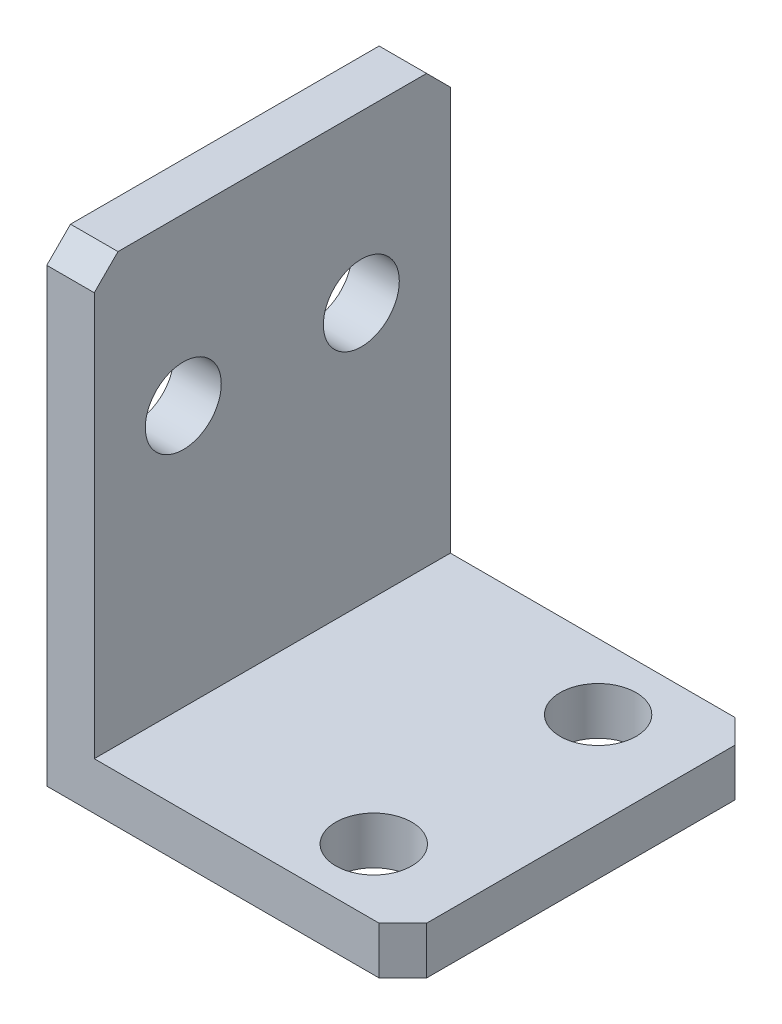
from build123d import *

# Parameters (mm, degrees)
BODY_DEPTH              = 15
CHAMFER1_SIZE           = 1
F_3_2_3_2_FORSENSOR_D   = 3.2
F_3_2_3_2_FORCARRIAGE_D = 3.2


with BuildPart() as part:
    # Sketch1 → Body (new body)
    with BuildSketch(Plane.XY):
        Polygon((0, 0), (0, 20), (2, 20), (2, 2), (15, 2), (15, 0), align=None)
    extrude(amount=BODY_DEPTH)

    # Chamfer1
    chamfer1_edges = [part.edges().sort_by_distance(p)[0] for p in [
        (1, 20, 15),
        (1, 20, 0),
        (15, 1, 15),
        (15, 1, 0),
    ]]
    chamfer(chamfer1_edges, length=CHAMFER1_SIZE)

    # Ø3.2 (3.2) ForSensor (through all)
    with Locations(Plane(origin=(0, 2, 0), x_dir=(1, 0, 0), z_dir=(0, 1, 0))):
        with Locations((11, -2.775), (11, -12.225)):
            Hole(F_3_2_3_2_FORSENSOR_D / 2)

    # Ø3.2 (3.2) ForCarriage (through all)
    with Locations(Plane(origin=(2, 0, 0), x_dir=(0, 0, -1), z_dir=(1, 0, 0))):
        with Locations((-11.25, 13), (-3.75, 13)):
            Hole(F_3_2_3_2_FORCARRIAGE_D / 2)


solid = part.part
